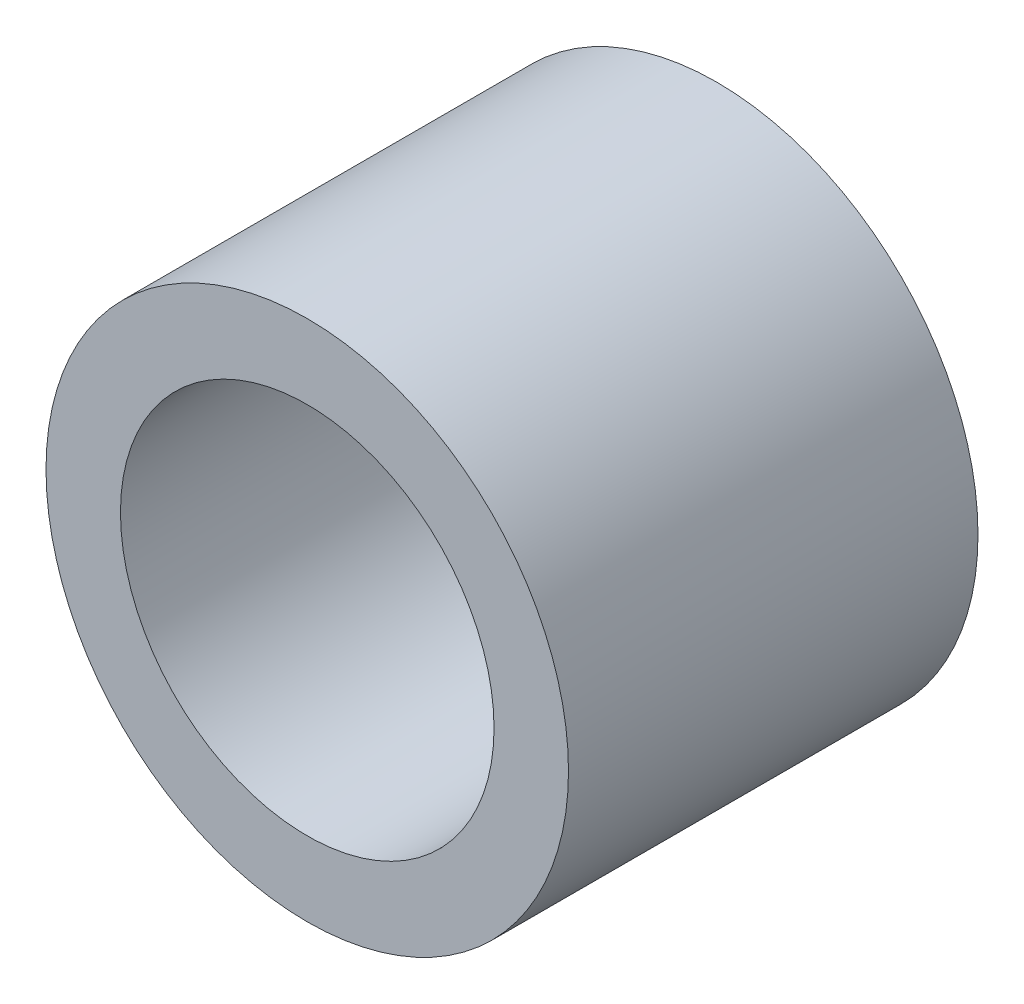
from build123d import *

# Parameters (mm, degrees)
SKETCH1_R           = 21.053
SKETCH1_R_2         = 15.053
BOSS_EXTRUDE1_DEPTH = 33


with BuildPart() as part:
    # Sketch1 → Boss-Extrude1 (new body)
    with BuildSketch(Plane.XY):
        Circle(SKETCH1_R)
        Circle(SKETCH1_R_2, mode=Mode.SUBTRACT)
    extrude(amount=BOSS_EXTRUDE1_DEPTH)


solid = part.part
